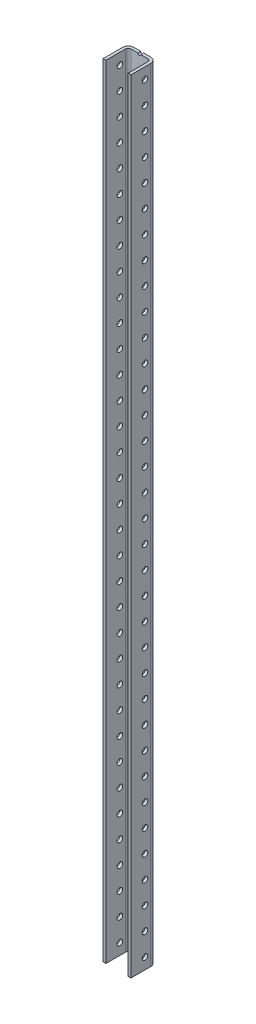
from build123d import *

# Parameters (mm, degrees)
BOSS_EXTRUDE1_DEPTH = 444.5
SKETCH3_R           = 1.651
SKETCH3_R_2         = 4.826
SKETCH3_R_3         = 1.5875
CUT_EXTRUDE1_DEPTH  = 446.700343561
SKETCH4_R           = 3.175
CUT_EXTRUDE2_DEPTH  = 447.547694121
LPATTERN1_COUNT     = 35
LPATTERN1_PITCH     = 25.4


with BuildPart() as part:
    # Sketch2 → Boss-Extrude1 (new, symmetric)
    with BuildSketch(Plane(origin=(0, 0, 0), x_dir=(1, 0, 0), z_dir=(0, 1, 0))):
        with BuildLine():
            Line((-12.7, 0), (-12.7, 22.225))
            ThreePointArc((-12.7, 22.225), (-11.77006403, 24.47006403), (-9.525, 25.4))
            Line((-9.525, 25.4), (9.525, 25.4))
            ThreePointArc((9.525, 25.4), (11.77006403, 24.47006403), (12.7, 22.225))
            Line((12.7, 22.225), (12.7, 0))
            Line((12.7, 0), (15.875, 0))
            Line((15.875, 0), (15.875, 22.225))
            ThreePointArc((15.875, 22.225), (14.015128061, 26.715128061), (9.525, 28.575))
            Line((9.525, 28.575), (-9.525, 28.575))
            ThreePointArc((-9.525, 28.575), (-14.015128061, 26.715128061), (-15.875, 22.225))
            Line((-15.875, 22.225), (-15.875, 0))
            Line((-15.875, 0), (-12.7, 0))
        make_face()
    extrude(amount=BOSS_EXTRUDE1_DEPTH, both=True)

    # Sketch3 → Cut-Extrude1 (cut, through all)
    with BuildSketch(Plane(origin=(0, 0, -28.575), x_dir=(-1, 0, 0), z_dir=(0, 0, -1))):
        with Locations((0, 444.5)):
            Circle(SKETCH3_R)
        with Locations((-2.032, 361.95)):
            Circle(SKETCH3_R_2)
        with Locations((-2.032, 336.55)):
            Circle(SKETCH3_R_2)
        with Locations((-2.032, 107.95)):
            Circle(SKETCH3_R_2)
        with Locations((-2.032, 82.55)):
            Circle(SKETCH3_R_2)
        with Locations((-2.032, -107.95)):
            Circle(SKETCH3_R_2)
        with Locations((-2.032, -82.55)):
            Circle(SKETCH3_R_2)
        with Locations((0, -241.3)):
            Circle(SKETCH3_R_3)
        with Locations((2.032, 0)):
            Circle(SKETCH3_R_2)
        with Locations((-2.032, -336.55)):
            Circle(SKETCH3_R_2)
        with Locations((-2.032, -361.95)):
            Circle(SKETCH3_R_2)
    extrude(amount=-CUT_EXTRUDE1_DEPTH, mode=Mode.SUBTRACT)

    # Sketch4 → Cut-Extrude2 (cut, through all)
    with BuildSketch(Plane(origin=(15.875, 0, 0), x_dir=(0, 0, -1), z_dir=(1, 0, 0))):
        with Locations((15.875, 431.8)):
            Circle(SKETCH4_R)
    cut_extrude2 = extrude(amount=-CUT_EXTRUDE2_DEPTH, mode=Mode.SUBTRACT)

    # LPattern1: Cut-Extrude2 ×35
    with Locations(*[(0, -i * LPATTERN1_PITCH, 0) for i in range(1, LPATTERN1_COUNT)]):
        add(cut_extrude2, mode=Mode.SUBTRACT)


solid = part.part
